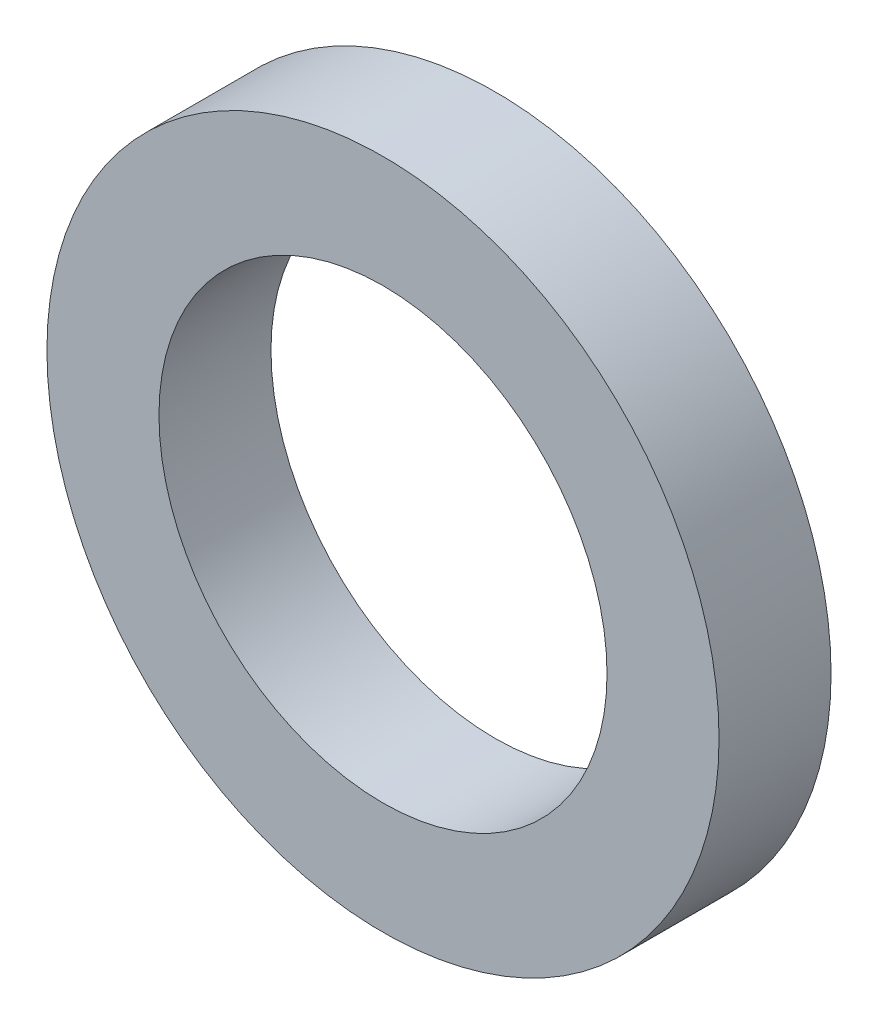
from build123d import *

# Parameters (mm, degrees)
SKETCH1_R           = 14.2875
SKETCH1_R_2         = 9.525
BOSS_EXTRUDE1_DEPTH = 4.7625


with BuildPart() as part:
    # Sketch1 → Boss-Extrude1 (new body)
    with BuildSketch(Plane.XY):
        with Locations(Location((0, 0, 0), (0, 0, 180))):
            Circle(SKETCH1_R)
        with Locations(Location((0, 0, 0), (0, 0, 180))):
            Circle(SKETCH1_R_2, mode=Mode.SUBTRACT)
    extrude(amount=BOSS_EXTRUDE1_DEPTH)


solid = part.part
